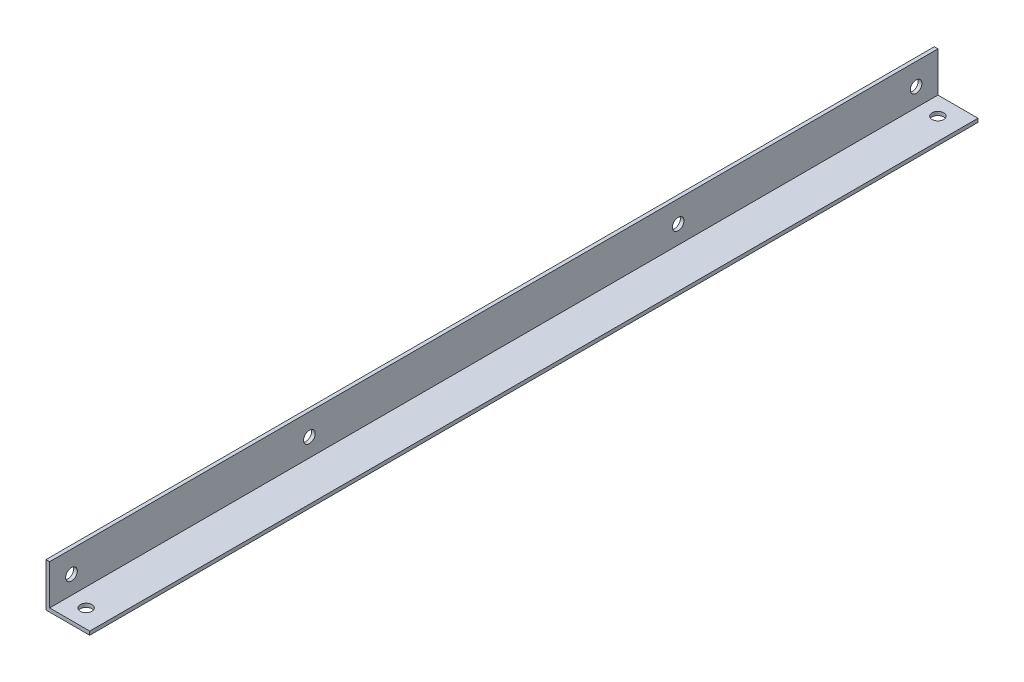
from build123d import *

# Parameters (mm, degrees)
BOSS_EXTRUDE1_DEPTH = 609.6
SKETCH2_R           = 4
CUT_EXTRUDE1_DEPTH  = 611.956962478
SKETCH3_R           = 4
CUT_EXTRUDE2_DEPTH  = 611.956962478


with BuildPart() as part:
    # Sketch1 → Boss-Extrude1 (new body)
    with BuildSketch(Plane.XY):
        Polygon((0, 0), (0, 30), (2.5, 30), (2.5, 2.5), (30, 2.5), (30, 0), align=None)
    extrude(amount=BOSS_EXTRUDE1_DEPTH)

    # Sketch2 → Cut-Extrude1 (cut, through all)
    with BuildSketch(Plane(origin=(2.5, 0, 0), x_dir=(0, 0, -1), z_dir=(1, 0, 0))):
        with Locations(Location((-594.6, 15, 0), (0, 0, 90))):
            Circle(SKETCH2_R)
        with Locations(Location((-15, 15, 0), (0, 0, 270))):
            Circle(SKETCH2_R)
        with Locations(Location((-431.3434763, 15, 0), (0, 0, 90))):
            Circle(SKETCH2_R)
        with Locations(Location((-178.2565237, 15, 0), (0, 0, 270))):
            Circle(SKETCH2_R)
    extrude(amount=-CUT_EXTRUDE1_DEPTH, mode=Mode.SUBTRACT)

    # Sketch3 → Cut-Extrude2 (cut, through all)
    with BuildSketch(Plane(origin=(0, 2.5, 0), x_dir=(1, 0, 0), z_dir=(0, 1, 0))):
        with Locations(Location((15, -12.5, 0), (0, 0, 180))):
            Circle(SKETCH3_R)
        with Locations(Location((15, -597.1, 0), (0, 0, 180))):
            Circle(SKETCH3_R)
    extrude(amount=-CUT_EXTRUDE2_DEPTH, mode=Mode.SUBTRACT)


solid = part.part
